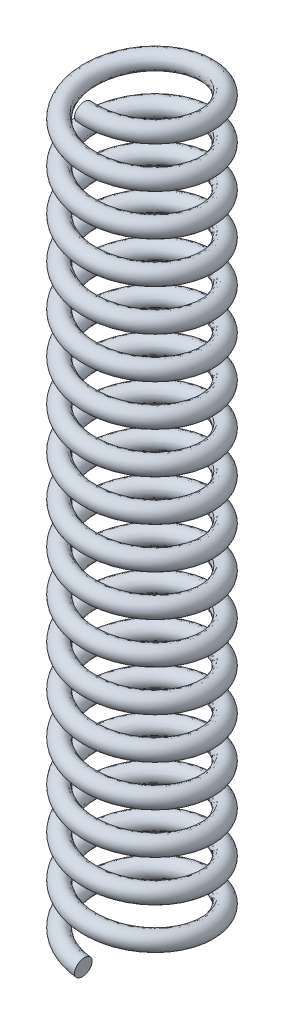
from build123d import *

# Parameters (mm, degrees)
COIL_WIRE_PITCH     = 2.809562016
COIL_WIRE_HEIGHT    = 50.572116295
COIL_WIRE_RADIUS    = 4
COIL_WIRE_PROFILE_R = 0.6


with BuildPart() as part:
    # Coil_Wire: sweep along a helix
    with BuildLine() as coil_wire_path:
        Helix(COIL_WIRE_PITCH, COIL_WIRE_HEIGHT, COIL_WIRE_RADIUS, center=(0, 0, 0), direction=(0, 1, 0), lefthand=True)
    # Coil_Wire profile (on start of the path) → Coil_Wire (sweep)
    with BuildSketch(Plane(origin=(0, 0, 4), x_dir=(-0.11109690019528755, -0.9938095787257226, 0), z_dir=(-0.9938095787257226, 0.11109690019528755, 2.219963736634069e-13))):
        Circle(COIL_WIRE_PROFILE_R)
    sweep(path=coil_wire_path.line, is_frenet=True)


solid = part.part
